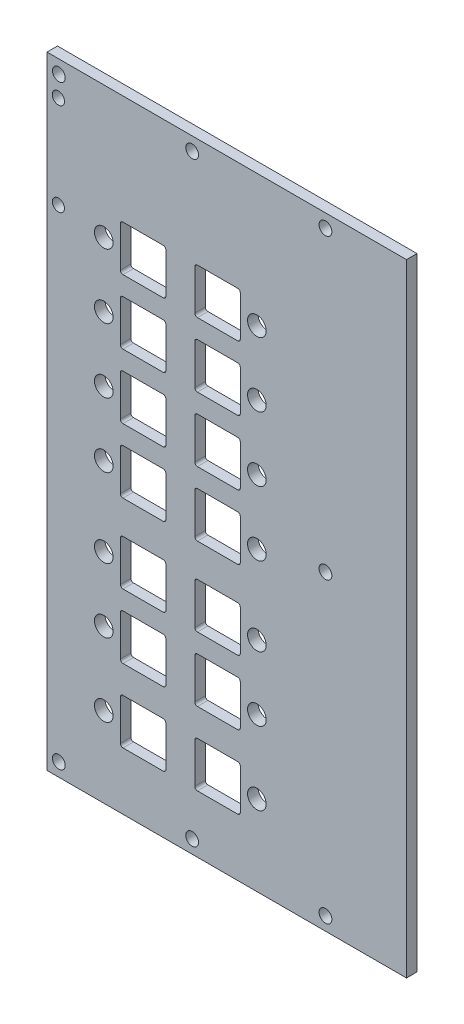
from build123d import *

# Parameters (mm, degrees)
SKETCH1_W            = 102.743
SKETCH1_H            = 177.8
BOSS_EXTRUDE1_DEPTH  = 2.999994
CUT_EXTRUDE1_DEPTH   = 5.08
LPATTERN1_COUNT      = 2
LPATTERN1_PITCH      = 21.26996
LPATTERN1_COUNT_DIR2 = 4
LPATTERN1_PITCH_DIR2 = 18.4375044
SKETCH4_R            = 2.667
CUT_EXTRUDE3_DEPTH   = 5.08
LPATTERN3_COUNT      = 4
LPATTERN3_PITCH      = 18.4375044
LPATTERN3_COUNT_DIR2 = 2
LPATTERN3_PITCH_DIR2 = 43.74896
CUT_EXTRUDE4_DEPTH   = 5.08
LPATTERN5_COUNT      = 2
LPATTERN5_PITCH      = 21.26996
LPATTERN5_COUNT_DIR2 = 2
LPATTERN5_PITCH_DIR2 = 18.4375044
SKETCH6_R            = 2.667
CUT_EXTRUDE5_DEPTH   = 5.08
LPATTERN6_COUNT      = 2
LPATTERN6_PITCH      = 18.4375044
LPATTERN6_COUNT_DIR2 = 2
LPATTERN6_PITCH_DIR2 = 43.74896
SKETCH7_R            = 1.8288
CUT_EXTRUDE6_DEPTH   = 5.08
LPATTERN7_COUNT      = 3
LPATTERN7_PITCH      = 85.09
LPATTERN7_COUNT_DIR2 = 3
LPATTERN7_PITCH_DIR2 = 38.1
LPATTERN8_COUNT      = 2
LPATTERN8_PITCH      = 39.335
LPATTERN8_COUNT_DIR2 = 2
LPATTERN8_PITCH_DIR2 = 21.26995
LPATTERN9_COUNT      = 2
LPATTERN9_PITCH      = 39.335
LPATTERN9_COUNT_DIR2 = 2
LPATTERN9_PITCH_DIR2 = 43.74896
SKETCH8_R            = 1.732335063
SKETCH8_R_2          = 1.75
CUT_EXTRUDE7_DEPTH   = 10


with BuildPart() as part:
    # Sketch1 → Boss-Extrude1 (new body)
    with BuildSketch(Plane.XY):
        with Locations((11.057282836, -51.76121775)):
            Rectangle(SKETCH1_W, SKETCH1_H)
    extrude(amount=BOSS_EXTRUDE1_DEPTH)

    # Sketch2 → Cut-Extrude1 (cut)
    with BuildSketch(Plane(origin=(0, 0, 0), x_dir=(-1, 0, 0), z_dir=(0, 0, -1))):
        with BuildLine():
            Line((-14.170621796, 5.91470195), (-2.670624476, 5.91470195))
            ThreePointArc((-2.670624476, 5.91470195), (-2.140293655, 5.695031731), (-1.920623436, 5.16470091))
            Line((-1.920623436, 5.16470091), (-1.920623436, -6.33529641))
            ThreePointArc((-1.920623436, -6.33529641), (-2.140293655, -6.865627231), (-2.670624476, -7.08529745))
            Line((-2.670624476, -7.08529745), (-14.170621796, -7.08529745))
            ThreePointArc((-14.170621796, -7.08529745), (-14.700952618, -6.865627231), (-14.920622836, -6.33529641))
            Line((-14.920622836, -6.33529641), (-14.920622836, 5.16470091))
            ThreePointArc((-14.920622836, 5.16470091), (-14.700952618, 5.695031731), (-14.170621796, 5.91470195))
        make_face()
    cut_extrude1 = extrude(amount=-CUT_EXTRUDE1_DEPTH, mode=Mode.SUBTRACT)

    # LPattern1: Cut-Extrude1 2 × 4
    with Locations(*[(-i * LPATTERN1_PITCH, -j * LPATTERN1_PITCH_DIR2, 0) for i in range(LPATTERN1_COUNT) for j in range(LPATTERN1_COUNT_DIR2) if (i, j) != (0, 0)]):
        add(cut_extrude1, mode=Mode.SUBTRACT)

    # Sketch4 → Cut-Extrude3 (cut)
    with BuildSketch(Plane(origin=(0, 0, 0), x_dir=(-1, 0, 0), z_dir=(0, 0, -1))):
        with Locations((-19.660262836, -0.58529775)):
            Circle(SKETCH4_R)
    cut_extrude3 = extrude(amount=-CUT_EXTRUDE3_DEPTH, mode=Mode.SUBTRACT)

    # LPattern3: Cut-Extrude3 4 × 2
    with Locations(*[(-j * LPATTERN3_PITCH_DIR2, -i * LPATTERN3_PITCH, 0) for i in range(LPATTERN3_COUNT) for j in range(LPATTERN3_COUNT_DIR2) if (i, j) != (0, 0)]):
        add(cut_extrude3, mode=Mode.SUBTRACT)

    # Sketch5 → Cut-Extrude4 (cut)
    with BuildSketch(Plane(origin=(0, 0, 0), x_dir=(-1, 0, 0), z_dir=(0, 0, -1))):
        with BuildLine():
            Line((-14.170621796, -71.88803905), (-2.670624476, -71.88803905))
            ThreePointArc((-2.670624476, -71.88803905), (-2.140293655, -72.107709269), (-1.920623436, -72.63804009))
            Line((-1.920623436, -72.63804009), (-1.920623436, -84.13803741))
            ThreePointArc((-1.920623436, -84.13803741), (-2.140293655, -84.668368231), (-2.670624476, -84.88803845))
            Line((-2.670624476, -84.88803845), (-14.170621796, -84.88803845))
            ThreePointArc((-14.170621796, -84.88803845), (-14.700952618, -84.668368231), (-14.920622836, -84.13803741))
            Line((-14.920622836, -84.13803741), (-14.920622836, -72.63804009))
            ThreePointArc((-14.920622836, -72.63804009), (-14.700952618, -72.107709269), (-14.170621796, -71.88803905))
        make_face()
    cut_extrude4 = extrude(amount=-CUT_EXTRUDE4_DEPTH, mode=Mode.SUBTRACT)

    # LPattern5: Cut-Extrude4 2 × 2
    with Locations(*[(-i * LPATTERN5_PITCH, -j * LPATTERN5_PITCH_DIR2, 0) for i in range(LPATTERN5_COUNT) for j in range(LPATTERN5_COUNT_DIR2) if (i, j) != (0, 0)]):
        add(cut_extrude4, mode=Mode.SUBTRACT)

    # Sketch6 → Cut-Extrude5 (cut)
    with BuildSketch(Plane(origin=(0, 0, 0), x_dir=(-1, 0, 0), z_dir=(0, 0, -1))):
        with Locations((-19.660262836, -78.38803875)):
            Circle(SKETCH6_R)
    cut_extrude5 = extrude(amount=-CUT_EXTRUDE5_DEPTH, mode=Mode.SUBTRACT)

    # LPattern6: Cut-Extrude5 2 × 2
    with Locations(*[(-j * LPATTERN6_PITCH_DIR2, -i * LPATTERN6_PITCH, 0) for i in range(LPATTERN6_COUNT) for j in range(LPATTERN6_COUNT_DIR2) if (i, j) != (0, 0)]):
        add(cut_extrude5, mode=Mode.SUBTRACT)

    # Sketch7 → Cut-Extrude6 (cut)
    with BuildSketch(Plane(origin=(0, 0, 0), x_dir=(-1, 0, 0), z_dir=(0, 0, -1))):
        with Locations((36.936017164, -136.85121775)):
            Circle(SKETCH7_R)
    cut_extrude6 = extrude(amount=-CUT_EXTRUDE6_DEPTH, mode=Mode.SUBTRACT)

    # LPattern7: Cut-Extrude6 3 × 3, 2 skipped
    with Locations(*[(j * LPATTERN7_PITCH_DIR2, i * LPATTERN7_PITCH, 0) for i in range(LPATTERN7_COUNT) for j in range(LPATTERN7_COUNT_DIR2) if (i, j) not in ((0, 0), (1, 0), (1, 1))]):
        add(cut_extrude6, mode=Mode.SUBTRACT)

    # LPattern8: Cut-Extrude4 2 × 2, 1 skipped
    with Locations(*[(-j * LPATTERN8_PITCH_DIR2, -i * LPATTERN8_PITCH, 0) for i in range(LPATTERN8_COUNT) for j in range(LPATTERN8_COUNT_DIR2) if (i, j) not in ((0, 0), (0, 1))]):
        add(cut_extrude4, mode=Mode.SUBTRACT)

    # LPattern9: Cut-Extrude5 2 × 2, 1 skipped
    with Locations(*[(-j * LPATTERN9_PITCH_DIR2, -i * LPATTERN9_PITCH, 0) for i in range(LPATTERN9_COUNT) for j in range(LPATTERN9_COUNT_DIR2) if (i, j) not in ((0, 0), (0, 1))]):
        add(cut_extrude5, mode=Mode.SUBTRACT)

    # Sketch8 → Cut-Extrude7 (cut)
    with BuildSketch(Plane.XY.offset(2.999994)):
        with Locations((-37.061467252, 0.91712789)):
            Circle(SKETCH8_R)
        with Locations((-37.055725164, 27.40042225)):
            Circle(SKETCH8_R_2)
    extrude(amount=-CUT_EXTRUDE7_DEPTH, mode=Mode.SUBTRACT)


solid = part.part
